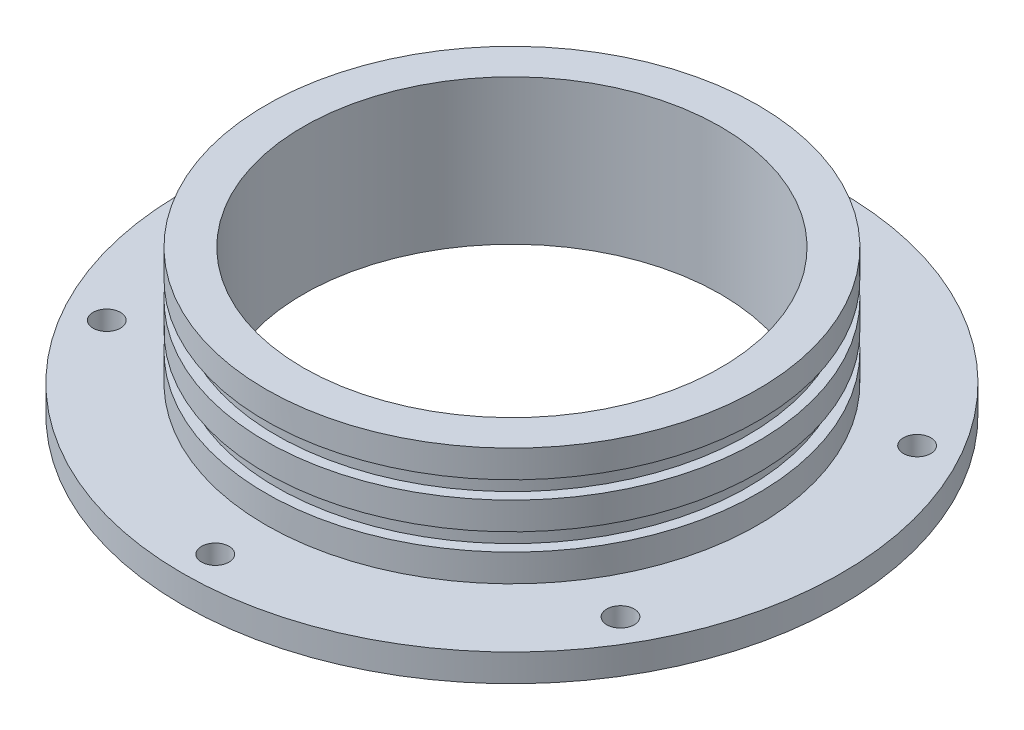
from build123d import *

# Parameters (mm, degrees)
SKETCH1_R           = 60
SKETCH1_R_2         = 38
BOSS_EXTRUDE1_DEPTH = 5
SKETCH2_R           = 44.8
SKETCH2_R_2         = 38
BOSS_EXTRUDE2_DEPTH = 21.4
SKETCH4_R           = 2.5
CUT_EXTRUDE1_DEPTH  = 20


with BuildPart() as part:
    # Sketch1 → Boss-Extrude1 (new body)
    with BuildSketch(Plane(origin=(0, 0, 0), x_dir=(1, 0, 0), z_dir=(0, 1, 0))):
        with Locations(Location((0, 0, 0), (0, 0, 270))):
            Circle(SKETCH1_R)
        with Locations(Location((0, 0, 0), (0, 0, 270))):
            Circle(SKETCH1_R_2, mode=Mode.SUBTRACT)
    extrude(amount=BOSS_EXTRUDE1_DEPTH)

    # Sketch2 → Boss-Extrude2 (add)
    with BuildSketch(Plane(origin=(0, 5, 0), x_dir=(1, 0, 0), z_dir=(0, 1, 0))):
        with Locations(Location((0, 0, 0), (0, 0, 270))):
            Circle(SKETCH2_R)
        with Locations(Location((0, 0, 0), (0, 0, 270))):
            Circle(SKETCH2_R_2, mode=Mode.SUBTRACT)
    extrude(amount=BOSS_EXTRUDE2_DEPTH)

    # Sketch3 → Cut-Revolve1 (revolve, cut)
    with BuildSketch(Plane(origin=(0, 0, 0), x_dir=(0, 0, -1), z_dir=(1, 0, 0)), mode=Mode.PRIVATE) as cut_revolve1_sk:
        Polygon((-45.972863263, 10), (-45.972863263, 18.2), (-45.972863263, 21.4), (-44.8, 21.4), (-42.9, 21.4), (-42.9, 18.2), (-44.8, 18.2), (-44.8, 13.2), (-42.9, 13.2), (-42.9, 10), (-44.8, 10), align=None)
    revolve(cut_revolve1_sk.sketch.rotate(Axis((0, 0, 0), (0, 1, 0)), 180), axis=Axis((0, 0, 0), (0, 1, 0)), mode=Mode.SUBTRACT)

    # Sketch4 → Cut-Extrude1 (cut)
    with BuildSketch(Plane.XZ):
        with Locations(Location((0, 54, 0), (0, 0, 270))):
            Circle(SKETCH4_R)
        with Locations(Location((46.765371804, 27, 0), (0, 0, 270))):
            Circle(SKETCH4_R)
        with Locations(Location((46.765371804, -27, 0), (0, 0, 270))):
            Circle(SKETCH4_R)
        with Locations(Location((0, -54, 0), (0, 0, 270))):
            Circle(SKETCH4_R)
        with Locations(Location((-46.765371804, -27, 0), (0, 0, 270))):
            Circle(SKETCH4_R)
        with Locations(Location((-46.765371804, 27, 0), (0, 0, 270))):
            Circle(SKETCH4_R)
    extrude(amount=-CUT_EXTRUDE1_DEPTH, mode=Mode.SUBTRACT)


solid = part.part
